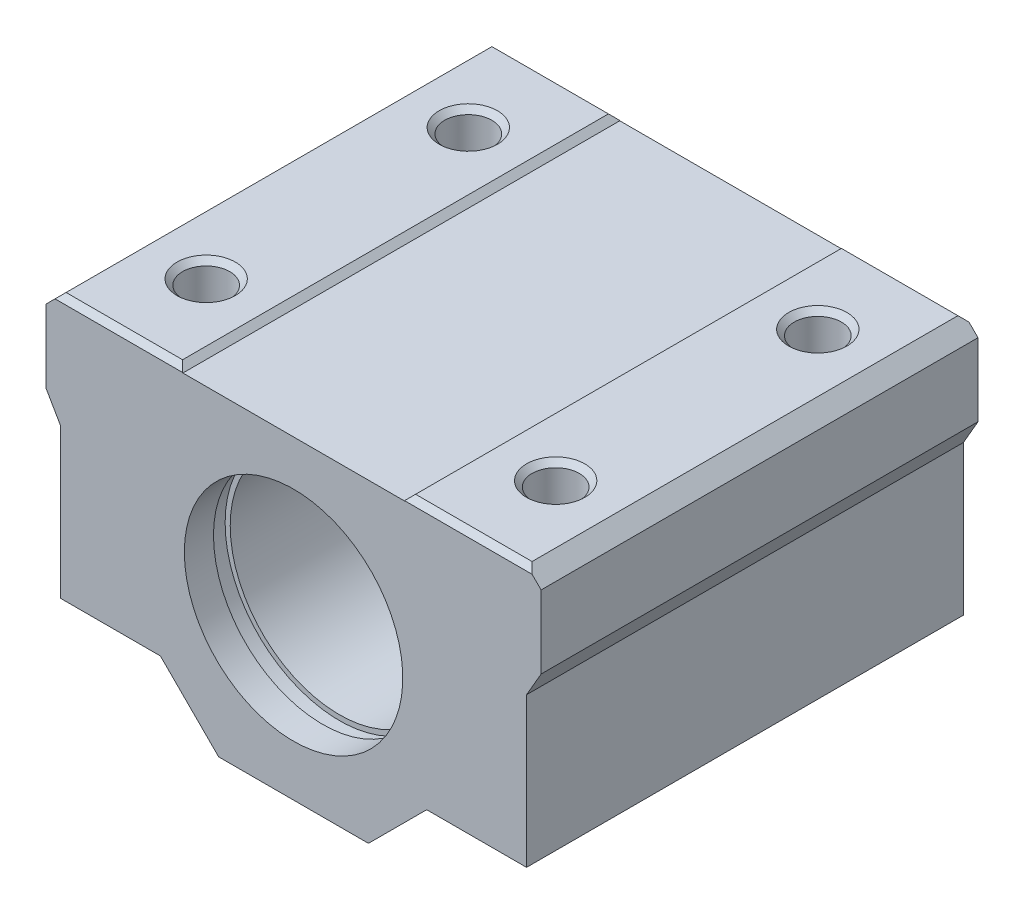
from build123d import *
from OCP.BRepFilletAPI import BRepFilletAPI_MakeChamfer

# Parameters (mm, degrees)
SCHIZZO1_W                   = 34
SCHIZZO1_H                   = 30
ESTRUSIONE_ESTRUSIONE1_DEPTH = 22
SCHIZZO2_W                   = 1
SCHIZZO2_H                   = 14.267949192
TAGLIO_ESTRUSIONE1_DEPTH     = 37.193922142
SCHIZZO3_W                   = 10.8571
SCHIZZO3_H                   = 4
TAGLIO_ESTRUSIONE2_DEPTH     = 37.193922142
SCHIZZO4_W                   = 11.8571
SCHIZZO4_H                   = 4
TAGLIO_ESTRUSIONE3_DEPTH     = 37.193922142
SCHIZZO5_W                   = 1
SCHIZZO5_H                   = 10.267949192
TAGLIO_ESTRUSIONE4_DEPTH     = 37.193922142
SCHIZZO6_W                   = 15.2
SCHIZZO6_H                   = 0.4
TAGLIO_ESTRUSIONE5_DEPTH     = 37.193922142
SFORMO1_ANGLE                = 60
SFORMO2_ANGLE                = 60
SFORMO3_ANGLE                = 45
SFORMO4_ANGLE                = 45
SMUSSO1_SIZE                 = 0.230940108
SMUSSO1_SIZE2                = 0.4
SMUSSO2_SIZE                 = 0.379
SMUSSO3_SIZE                 = 1


with BuildPart() as part:
    # Schizzo1 → Estrusione-Estrusione1 (new body)
    with BuildSketch(Plane(origin=(0, 11, 0), x_dir=(1, 0, 0), z_dir=(0, 1, 0))):
        with Locations((0, -15)):
            Rectangle(SCHIZZO1_W, SCHIZZO1_H)
    extrude(amount=-ESTRUSIONE_ESTRUSIONE1_DEPTH)

    # Schizzo2 → Taglio-Estrusione1 (cut, through all)
    with BuildSketch(Plane.XY.offset(30)):
        with Locations((16.5, -3.866025404)):
            Rectangle(SCHIZZO2_W, SCHIZZO2_H)
    extrude(amount=-TAGLIO_ESTRUSIONE1_DEPTH, mode=Mode.SUBTRACT)

    # Schizzo3 → Taglio-Estrusione2 (cut, through all)
    with BuildSketch(Plane.XY.offset(30)):
        with Locations((10.57145, -9)):
            Rectangle(SCHIZZO3_W, SCHIZZO3_H)
    extrude(amount=-TAGLIO_ESTRUSIONE2_DEPTH, mode=Mode.SUBTRACT)

    # Schizzo4 → Taglio-Estrusione3 (cut, through all)
    with BuildSketch(Plane.XY.offset(30)):
        with Locations((-11.07145, -9)):
            Rectangle(SCHIZZO4_W, SCHIZZO4_H)
    extrude(amount=-TAGLIO_ESTRUSIONE3_DEPTH, mode=Mode.SUBTRACT)

    # Schizzo5 → Taglio-Estrusione4 (cut, through all)
    with BuildSketch(Plane.XY.offset(30)):
        with Locations((-16.5, -1.866025404)):
            Rectangle(SCHIZZO5_W, SCHIZZO5_H)
    extrude(amount=-TAGLIO_ESTRUSIONE4_DEPTH, mode=Mode.SUBTRACT)

    # Schizzo6 → Taglio-Estrusione5 (cut, through all)
    with BuildSketch(Plane.XY.offset(30)):
        with Locations((0, 10.8)):
            Rectangle(SCHIZZO6_W, SCHIZZO6_H)
    extrude(amount=-TAGLIO_ESTRUSIONE5_DEPTH, mode=Mode.SUBTRACT)

    # Sformo1
    sformo1_faces = [part.faces().sort_by_distance(p)[0] for p in [
        (16.5, 3.267949192, 15),
    ]]
    draft(sformo1_faces, Plane(origin=(16, 3.267949192, 0), x_dir=(0, 0, 1), z_dir=(1, 0, 0)), SFORMO1_ANGLE)

    # Sformo2
    sformo2_faces = [part.faces().sort_by_distance(p)[0] for p in [
        (-16.5, 3.267949192, 15),
    ]]
    draft(sformo2_faces, Plane(origin=(-16, -7, 0), x_dir=(0, 0, -1), z_dir=(-1, 0, 0)), SFORMO2_ANGLE)

    # Sformo3
    sformo3_faces = [part.faces().sort_by_distance(p)[0] for p in [
        (5.1429, -9, 15),
        (-5.1429, -9, 15),
    ]]
    draft(sformo3_faces, Plane(origin=(0, -11, 0), x_dir=(0, 0, -1), z_dir=(0, -1, 0)), SFORMO3_ANGLE)

    # Sformo4
    sformo4_faces = [part.faces().sort_by_distance(p)[0] for p in [
        (-7.6, 10.8, 15),
        (7.6, 10.8, 15),
    ]]
    draft(sformo4_faces, Plane(origin=(-7.6, 10.6, 0), x_dir=(1, 0, 0), z_dir=(0, 1, 0)), SFORMO4_ANGLE)

    # Schizzo7 → Taglia-Rivoluzione1 (revolve, cut)
    with BuildSketch(Plane.XZ, mode=Mode.PRIVATE) as taglia_rivoluzione1_sk:
        Polygon((7.5, 30), (0, 30), (0, 0), (7.5, 0), (7.5, 2), (7.85, 2), (7.85, 3.15), (7.5, 3.15), (7.5, 26.85), (7.85, 26.85), (7.85, 28), (7.5, 28), align=None)
    revolve(taglia_rivoluzione1_sk.sketch.rotate(Axis((0, 0, 30), (0, 0, -1)), 180), axis=Axis((0, 0, 30), (0, 0, -1)), mode=Mode.SUBTRACT)

    # Schizzo8 → Taglia-Rivoluzione2 (revolve, cut)
    with BuildSketch(Plane.XY.offset(6), mode=Mode.PRIVATE) as taglia_rivoluzione2_sk:
        Polygon((-10.379, 11), (-12, 11), (-12, -7), (-10.3, -7), (-10.3, 3), (-10.379, 3), align=None)
    revolve(taglia_rivoluzione2_sk.sketch.rotate(Axis((-12, 11, 6), (0, -1, 0)), 270), axis=Axis((-12, 11, 6), (0, -1, 0)), mode=Mode.SUBTRACT)

    # Schizzo9 → Taglia-Rivoluzione3 (revolve, cut)
    with BuildSketch(Plane.XY.offset(24), mode=Mode.PRIVATE) as taglia_rivoluzione3_sk:
        Polygon((-10.379, 11), (-12, 11), (-12, -7), (-10.3, -7), (-10.3, 3), (-10.379, 3), align=None)
    revolve(taglia_rivoluzione3_sk.sketch.rotate(Axis((-12, 11, 24), (0, -1, 0)), 270), axis=Axis((-12, 11, 24), (0, -1, 0)), mode=Mode.SUBTRACT)

    # Schizzo10 → Taglia-Rivoluzione4 (revolve, cut)
    with BuildSketch(Plane.XY.offset(6), mode=Mode.PRIVATE) as taglia_rivoluzione4_sk:
        Polygon((13.621, 11), (12, 11), (12, -7), (13.7, -7), (13.7, 3), (13.621, 3), align=None)
    revolve(taglia_rivoluzione4_sk.sketch.rotate(Axis((12, 11, 6), (0, -1, 0)), 270), axis=Axis((12, 11, 6), (0, -1, 0)), mode=Mode.SUBTRACT)

    # Schizzo11 → Taglia-Rivoluzione5 (revolve, cut)
    with BuildSketch(Plane.XY.offset(24), mode=Mode.PRIVATE) as taglia_rivoluzione5_sk:
        Polygon((13.621, 11), (12, 11), (12, -7), (13.7, -7), (13.7, 3), (13.621, 3), align=None)
    revolve(taglia_rivoluzione5_sk.sketch.rotate(Axis((12, 11, 24), (0, -1, 0)), 270), axis=Axis((12, 11, 24), (0, -1, 0)), mode=Mode.SUBTRACT)

    # Smusso1: one chamfer whose edges measure the first distance from different faces: ONE call of the kernel's chamfer builder (chamfer() names one face for all edges)
    smusso1_edges_1 = [part.edges().sort_by_distance(p)[0] for p in [
        (-12, -7, 7.7),
        (-12, -7, 25.7),
    ]]
    smusso1_side_1 = [part.faces().sort_by_distance(p)[0] for p in [
        (-12.626775869, -7, 15),
    ]]
    smusso1_edges_2 = [part.edges().sort_by_distance(p)[0] for p in [
        (12, -7, 7.7),
        (12, -7, 25.7),
    ]]
    smusso1_side_2 = [part.faces().sort_by_distance(p)[0] for p in [
        (12.626775869, -7, 15),
    ]]
    smusso1 = BRepFilletAPI_MakeChamfer(part.part.solid().wrapped)
    for e in smusso1_edges_1:
        smusso1.Add(SMUSSO1_SIZE, SMUSSO1_SIZE2, e.wrapped, smusso1_side_1[0].wrapped)  # the first distance lies on this face
    for e in smusso1_edges_2:
        smusso1.Add(SMUSSO1_SIZE, SMUSSO1_SIZE2, e.wrapped, smusso1_side_2[0].wrapped)  # the first distance lies on this face
    add(Compound.cast(smusso1.Shape()), mode=Mode.REPLACE)

    # Smusso2
    smusso2_edges = [part.edges().sort_by_distance(p)[0] for p in [
        (-12, 11, 7.621),
        (-12, 11, 25.621),
        (12, 11, 7.621),
        (12, 11, 25.621),
        (-12.5, 11, 30),
        (12.5, 11, 0),
        (-12.5, 11, 0),
        (12.5, 11, 30),
    ]]
    chamfer(smusso2_edges, length=SMUSSO2_SIZE)

    # Smusso3
    smusso3_edges = [part.edges().sort_by_distance(p)[0] for p in [
        (17, 11, 15),
        (-17, 11, 15),
    ]]
    chamfer(smusso3_edges, length=SMUSSO3_SIZE)


solid = part.part
